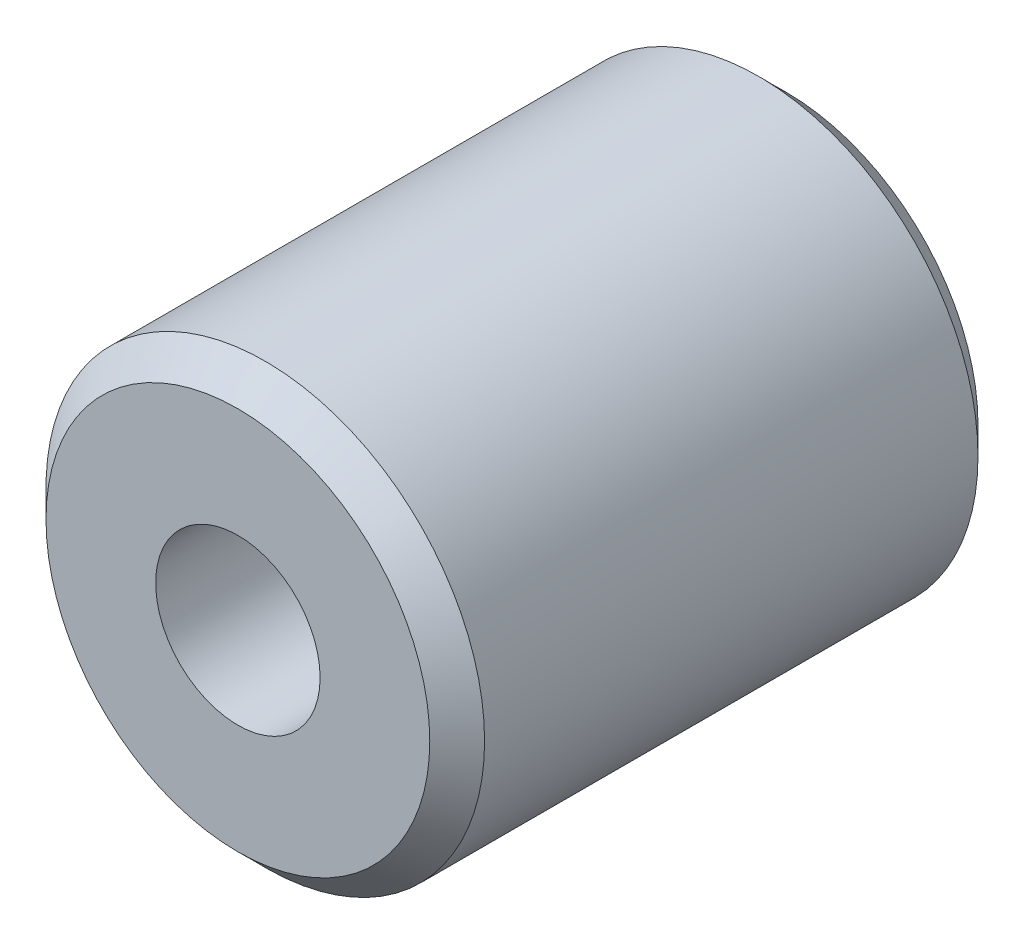
from build123d import *

# Parameters (mm, degrees)
ESQUISSE1_R             = 4
BASE_EXTRUSION_DEPTH    = 10
CHANFREIN1_SIZE         = 0.5
ESQUISSE2_R             = 1.5
ENL_V_MAT_EXTRU_1_DEPTH = 12.489125293
ENL_V_MAT_EXTRU_2_DEPTH = 6


with BuildPart() as part:
    # Esquisse1 → Base-Extrusion (new body)
    with BuildSketch(Plane.XY):
        Circle(ESQUISSE1_R)
    extrude(amount=BASE_EXTRUSION_DEPTH)

    # Chanfrein1
    chanfrein1_edges = [part.edges().sort_by_distance(p)[0] for p in [
        (-4, 0, 0),
        (-4, 0, 10),
    ]]
    chamfer(chanfrein1_edges, length=CHANFREIN1_SIZE)

    # Esquisse2 → Enlèv. mat.-Extru.1 (cut, through all)
    with BuildSketch(Plane.XY.offset(10)):
        Circle(ESQUISSE2_R)
    extrude(amount=-ENL_V_MAT_EXTRU_1_DEPTH, mode=Mode.SUBTRACT)

    # Esquisse3 → Enlèv. mat.-Extru.2 (cut)
    with BuildSketch(Plane(origin=(0, 0, 0), x_dir=(-1, 0, 0), z_dir=(0, 0, -1))):
        Polygon((1.58113883, 2.738612788), (-1.58113883, 2.738612788), (-3.16227766, 0), (-1.58113883, -2.738612788), (1.58113883, -2.738612788), (3.16227766, 0), align=None)
    extrude(amount=-ENL_V_MAT_EXTRU_2_DEPTH, mode=Mode.SUBTRACT)


solid = part.part
